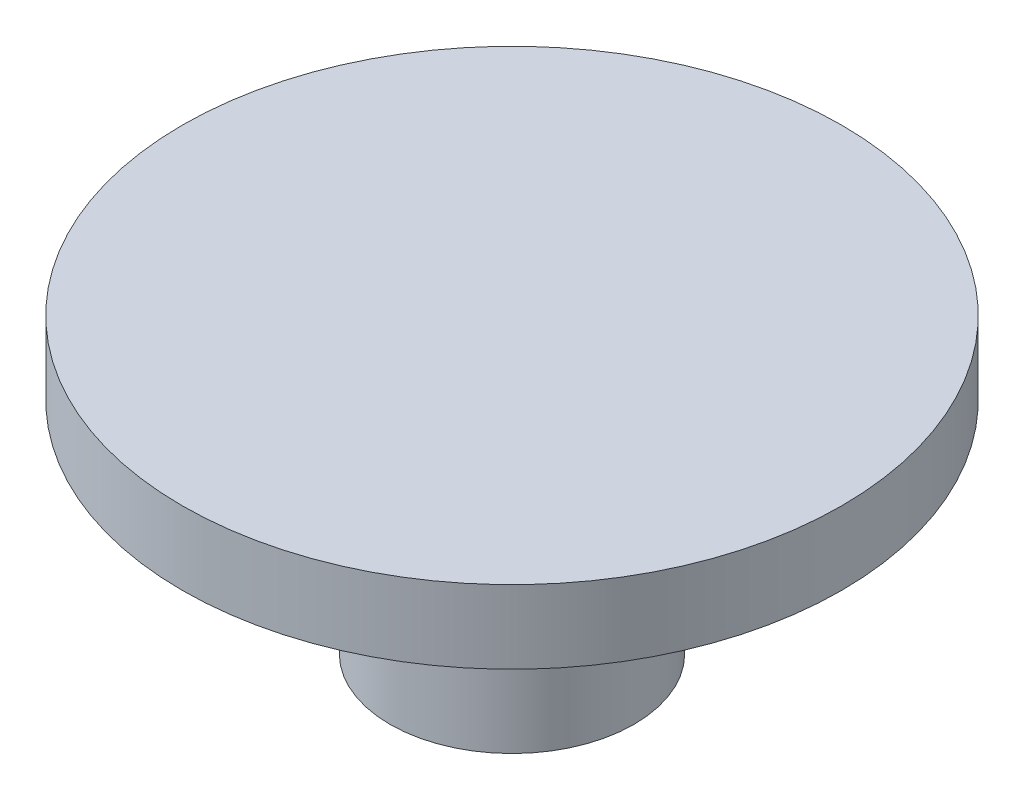
from build123d import *


with BuildPart() as part:
    # Sketch1 → Revolve1 (revolve)
    with BuildSketch(Plane.XY, mode=Mode.PRIVATE) as revolve1_sk:
        Polygon((0, 0), (5, 0), (5, 9), (13.5, 9), (13.5, 12), (0, 12), align=None)
    revolve(revolve1_sk.sketch.rotate(Axis((0, 12, 0), (0, -1, 0)), 90), axis=Axis((0, 12, 0), (0, -1, 0)))


solid = part.part
